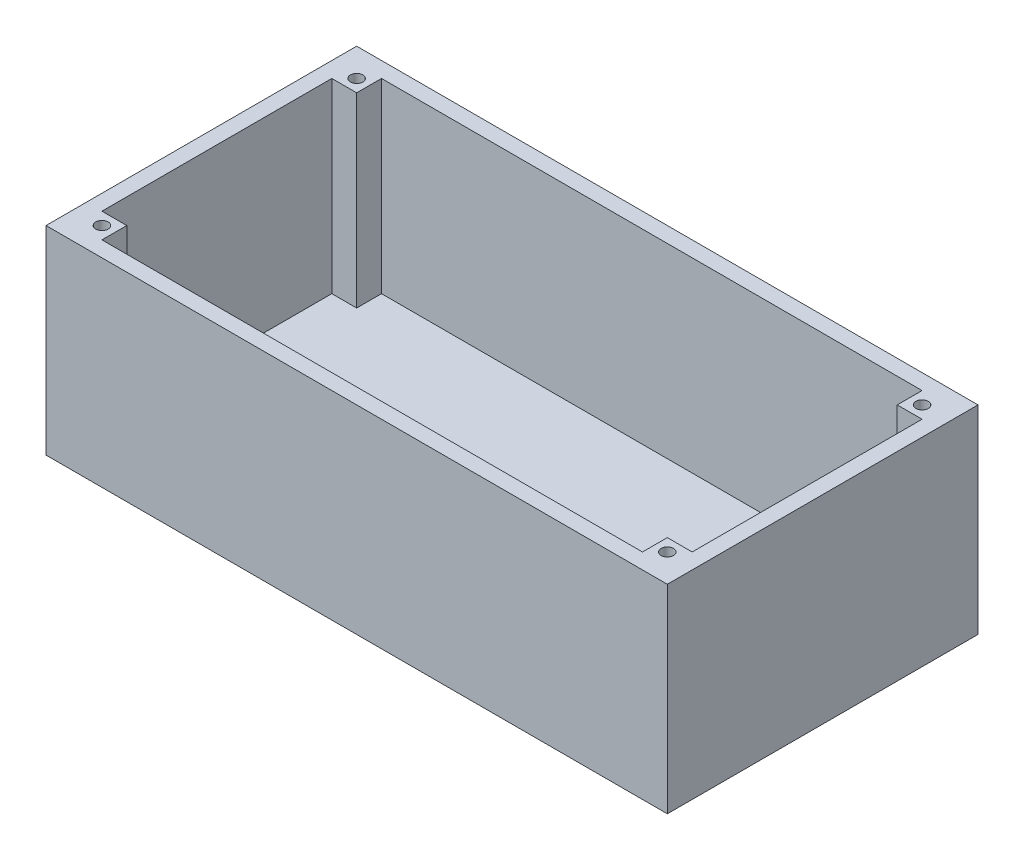
from build123d import *

# Parameters (mm, degrees)
SKETCH1_W           = 100
SKETCH1_H           = 50
BOSS_EXTRUDE1_DEPTH = 2
SKETCH3_W           = 100
SKETCH3_H           = 50
SKETCH3_R           = 1
BOSS_EXTRUDE2_DEPTH = 30


with BuildPart() as part:
    # Sketch1 → Boss-Extrude1 (new body)
    with BuildSketch(Plane(origin=(0, 0, 0), x_dir=(1, 0, 0), z_dir=(0, 1, 0))):
        with Locations((50, 25)):
            Rectangle(SKETCH1_W, SKETCH1_H)
    extrude(amount=BOSS_EXTRUDE1_DEPTH)

    # Sketch3 → Boss-Extrude2 (add)
    with BuildSketch(Plane(origin=(0, 2, 0), x_dir=(1, 0, 0), z_dir=(0, 1, 0))):
        with Locations((50, 25)):
            Rectangle(SKETCH3_W, SKETCH3_H)
        with Locations(Location((4.5, 45.5, 0), (0, 0, 270))):
            Circle(SKETCH3_R, mode=Mode.SUBTRACT)
        with Locations(Location((95.5, 45.5, 0), (0, 0, 270))):
            Circle(SKETCH3_R, mode=Mode.SUBTRACT)
        with Locations(Location((95.5, 4.5, 0), (0, 0, 270))):
            Circle(SKETCH3_R, mode=Mode.SUBTRACT)
        with Locations(Location((4.5, 4.5, 0), (0, 0, 270))):
            Circle(SKETCH3_R, mode=Mode.SUBTRACT)
        Polygon((6.5, 47.5), (93.5, 47.5), (93.5, 43.5), (97.5, 43.5), (97.5, 6.5), (93.5, 6.5), (93.5, 2.5), (6.5, 2.5), (6.5, 6.5), (2.5, 6.5), (2.5, 43.5), (6.5, 43.5), align=None, mode=Mode.SUBTRACT)
    extrude(amount=BOSS_EXTRUDE2_DEPTH)


solid = part.part
